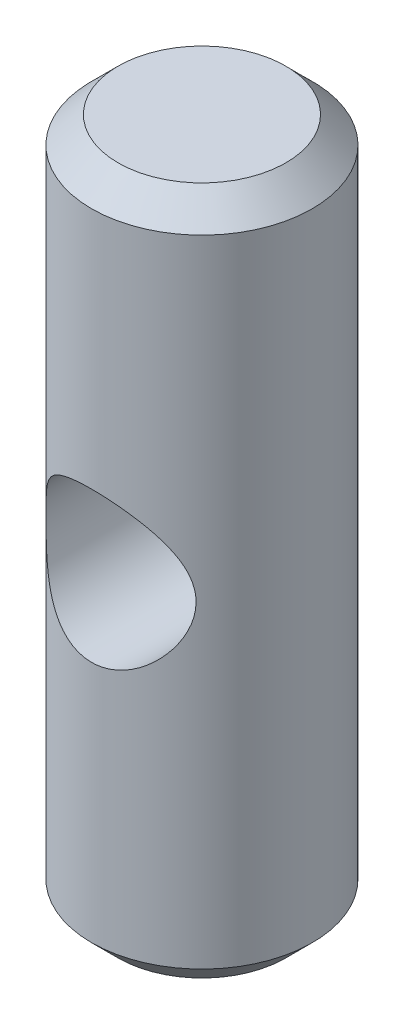
from build123d import *

# Parameters (mm, degrees)
SKETCH2_R               = 12.5
BOSS_EXTRUDE1_DEPTH     = 39
CUT_EXTRUDE1_DEPTH      = 43.819388132
CUT_EXTRUDE1_DEPTH_BACK = 43.819388132
SKETCH3_R               = 8.5
CHAMFER1_SIZE           = 3


with BuildPart() as part:
    # Sketch2 → Boss-Extrude1 (new, symmetric)
    with BuildSketch(Plane(origin=(0, 0, 0), x_dir=(1, 0, 0), z_dir=(0, 1, 0))):
        with Locations(Location((0, 0, 0), (0, 0, 270))):
            Circle(SKETCH2_R)
    extrude(amount=BOSS_EXTRUDE1_DEPTH, both=True)

    # Sketch3 → Cut-Extrude1 (cut, two sides: drawn at the far end of the back side and taken through both)
    with BuildSketch(Plane.XY.offset(-CUT_EXTRUDE1_DEPTH_BACK)):
        with Locations(Location((0, 0, 0), (0, 0, 90.000000009))):
            Circle(SKETCH3_R)
    extrude(amount=CUT_EXTRUDE1_DEPTH + CUT_EXTRUDE1_DEPTH_BACK, mode=Mode.SUBTRACT)

    # Chamfer1
    chamfer1_edges = [part.edges().sort_by_distance(p)[0] for p in [
        (0, -39, -12.5),
        (0, 39, -12.5),
    ]]
    chamfer(chamfer1_edges, length=CHAMFER1_SIZE)


solid = part.part
